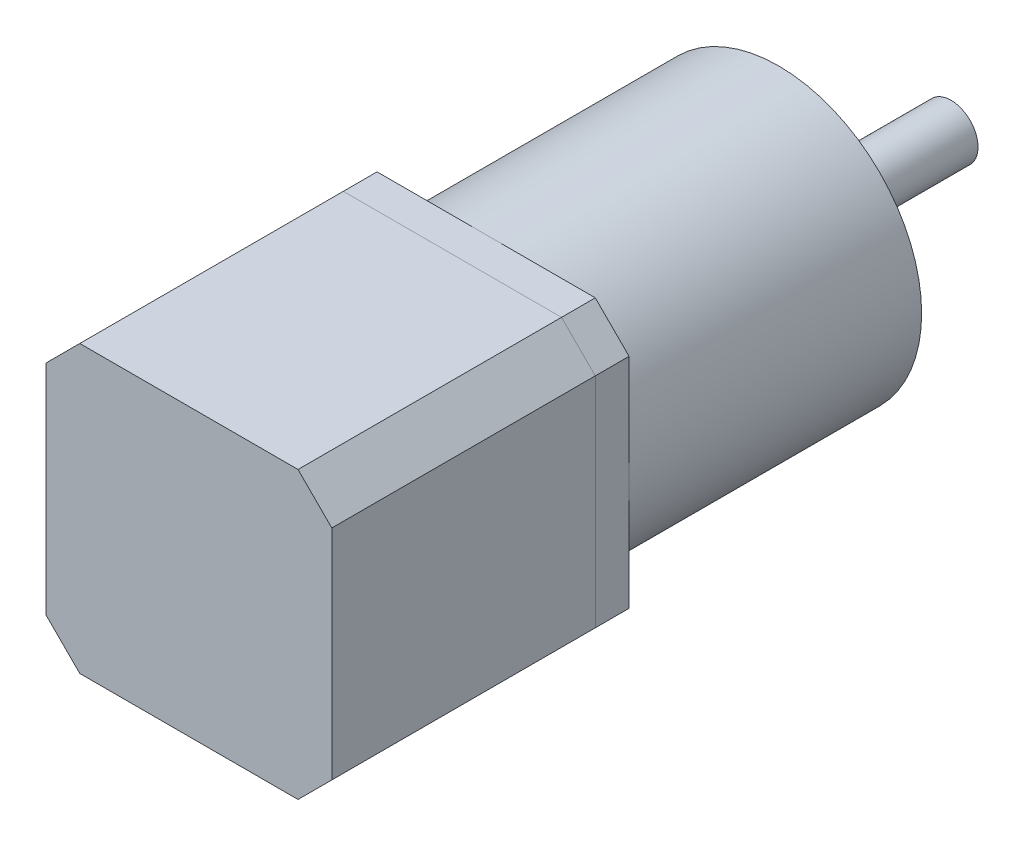
from build123d import *

# Parameters (mm, degrees)
SKETCH1_W           = 42.3
SKETCH1_H           = 42.3
BOSS_EXTRUDE1_DEPTH = 39
CHAMFER1_SIZE       = 5
SKETCH2_W           = 42.3
SKETCH2_H           = 42.3
BOSS_EXTRUDE2_DEPTH = 5
CHAMFER2_SIZE       = 5
SKETCH3_R           = 21.15
BOSS_EXTRUDE3_DEPTH = 43.3
SKETCH4_R           = 11
BOSS_EXTRUDE4_DEPTH = 2
SKETCH5_R           = 4
BOSS_EXTRUDE5_DEPTH = 23.5
SKETCH6_R           = 6.210975092
BOSS_EXTRUDE6_DEPTH = 0.5
SKETCH7_R           = 1.144150663
CUT_EXTRUDE1_DEPTH  = 10


with BuildPart() as part:
    # Sketch1 → Boss-Extrude1 (new body)
    with BuildSketch(Plane.XY):
        Rectangle(SKETCH1_W, SKETCH1_H)
    extrude(amount=BOSS_EXTRUDE1_DEPTH)

    # Chamfer1
    chamfer1_edges = [part.edges().sort_by_distance(p)[0] for p in [
        (21.15, -21.15, 19.5),
        (-21.15, -21.15, 19.5),
        (-21.15, 21.15, 19.5),
        (21.15, 21.15, 19.5),
    ]]
    chamfer(chamfer1_edges, length=CHAMFER1_SIZE)


with BuildPart() as body_2:
    # Sketch2 → Boss-Extrude2 (new body)
    with BuildSketch(Plane(origin=(0, 0, 0), x_dir=(-1, 0, 0), z_dir=(0, 0, -1))):
        Rectangle(SKETCH2_W, SKETCH2_H)
    extrude(amount=BOSS_EXTRUDE2_DEPTH)

    # Chamfer2
    chamfer2_edges = [body_2.edges().sort_by_distance(p)[0] for p in [
        (-21.15, -21.15, -2.5),
        (21.15, -21.15, -2.5),
        (21.15, 21.15, -2.5),
        (-21.15, 21.15, -2.5),
    ]]
    chamfer(chamfer2_edges, length=CHAMFER2_SIZE)


with BuildPart() as body_3:
    # Sketch3 → Boss-Extrude3 (new body)
    with BuildSketch(Plane(origin=(0, 0, -5), x_dir=(-1, 0, 0), z_dir=(0, 0, -1))):
        with Locations(Location((0, 0, 0), (0, 0, 180))):
            Circle(SKETCH3_R)
    extrude(amount=BOSS_EXTRUDE3_DEPTH)

    # Sketch7 → Cut-Extrude1 (cut)
    with BuildSketch(Plane(origin=(0, 0, -48.3), x_dir=(-1, 0, 0), z_dir=(0, 0, -1))):
        with Locations((0, 17.5)):
            Circle(SKETCH7_R)
        with Locations((17.5, 0)):
            Circle(SKETCH7_R)
        with Locations((0, -17.5)):
            Circle(SKETCH7_R)
        with Locations((-17.5, 0)):
            Circle(SKETCH7_R)
    extrude(amount=-CUT_EXTRUDE1_DEPTH, mode=Mode.SUBTRACT)


with BuildPart() as body_4:
    # Sketch4 → Boss-Extrude4 (new body)
    with BuildSketch(Plane(origin=(0, 0, -48.3), x_dir=(-1, 0, 0), z_dir=(0, 0, -1))):
        Circle(SKETCH4_R)
    extrude(amount=BOSS_EXTRUDE4_DEPTH)


with BuildPart() as body_5:
    # Sketch5 → Boss-Extrude5 (new body)
    with BuildSketch(Plane(origin=(0, 0, -50.3), x_dir=(-1, 0, 0), z_dir=(0, 0, -1))):
        Circle(SKETCH5_R)
    extrude(amount=BOSS_EXTRUDE5_DEPTH)


with BuildPart() as body_6:
    # Sketch6 → Boss-Extrude6 (new body)
    with BuildSketch(Plane(origin=(0, 0, -50.3), x_dir=(-1, 0, 0), z_dir=(0, 0, -1))):
        Circle(SKETCH6_R)
    extrude(amount=BOSS_EXTRUDE6_DEPTH)


solid = Compound([part.part, body_2.part, body_3.part, body_4.part, body_5.part, body_6.part])
